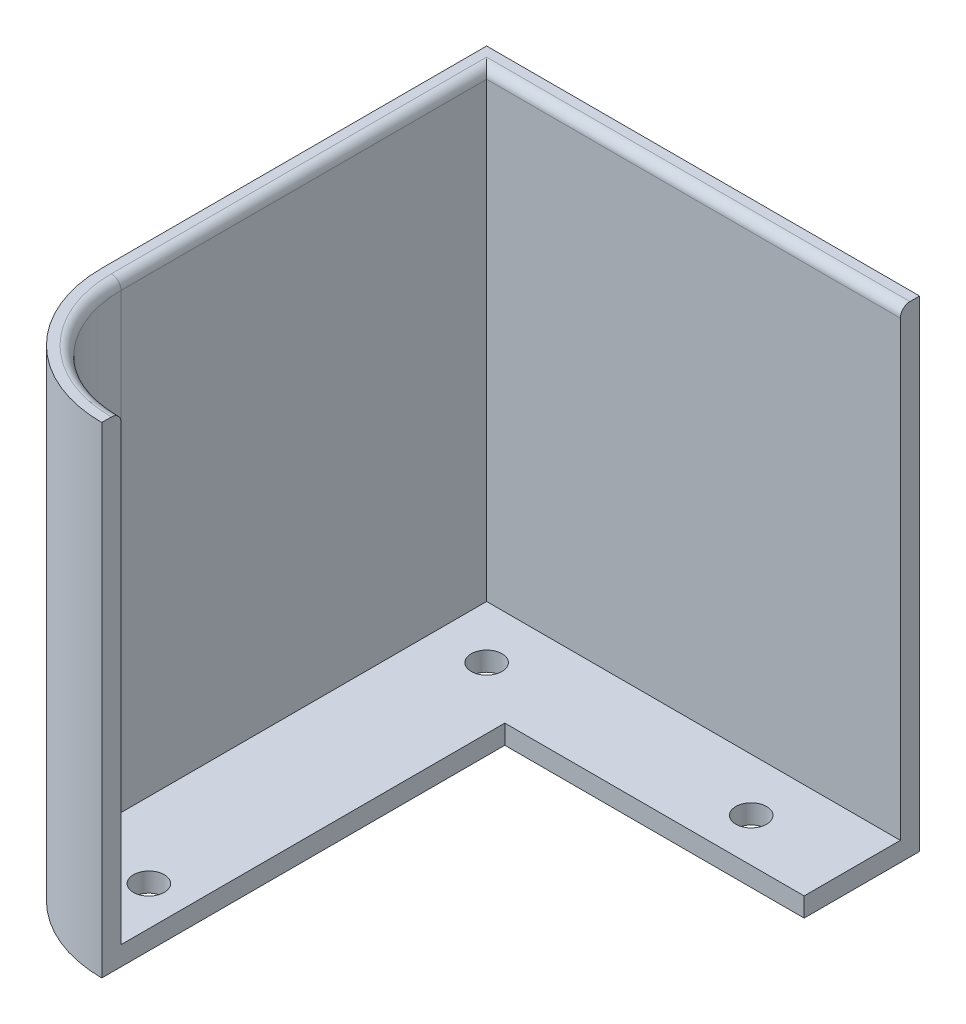
from build123d import *

# Parameters (mm, degrees)
BOSS_EXTRUDE1_DEPTH = 50
CUT_EXTRUDE1_DEPTH  = 48
SKETCH3_R           = 1.6
CUT_EXTRUDE2_DEPTH  = 840.282109633
FILLET3_R           = 1


with BuildPart() as part:
    # Sketch1 → Boss-Extrude1 (new body)
    with BuildSketch(Plane(origin=(0, 0, 0), x_dir=(1, 0, 0), z_dir=(0, 1, 0))):
        with BuildLine():
            Line((789.147942738, -65.404824394), (789.147942738, -25.404824394))
            Line((789.147942738, -25.404824394), (834.147942738, -25.404824394))
            Line((834.147942738, -25.404824394), (834.147942738, -37.404824394))
            Line((834.147942738, -37.404824394), (803.037942738, -37.404824394))
            Line((803.037942738, -37.404824394), (803.037942738, -58.807263418))
            Line((803.037942738, -58.807263418), (803.037942738, -79.294824394))
            ThreePointArc((803.037942738, -79.294824394), (793.216229548, -75.226537585), (789.147942738, -65.404824394))
        make_face()
    extrude(amount=BOSS_EXTRUDE1_DEPTH)

    # Sketch2 → Cut-Extrude1 (cut)
    with BuildSketch(Plane(origin=(0, 50, 0), x_dir=(1, 0, 0), z_dir=(0, 1, 0))):
        with BuildLine():
            Line((834.147942738, -27.404824394), (791.147942738, -27.404824394))
            Line((791.147942738, -27.404824394), (791.147942738, -65.404824394))
            ThreePointArc((791.147942738, -65.404824394), (794.630556885, -73.81166102), (803.037942738, -77.292949065))
            Line((803.037942738, -77.292949065), (834.147942738, -63.276412727))
            Line((834.147942738, -63.276412727), (834.147942738, -27.404824394))
        make_face()
    extrude(amount=-CUT_EXTRUDE1_DEPTH, mode=Mode.SUBTRACT)

    # Sketch3 → Cut-Extrude2 (cut, through all)
    with BuildSketch(Plane(origin=(0, 2, 0), x_dir=(1, 0, 0), z_dir=(0, 1, 0))):
        with Locations(Location((824.147942738, -32.904824394, 0), (0, 0, 270))):
            Circle(SKETCH3_R)
        with Locations(Location((796.647942738, -32.904824394, 0), (0, 0, 270))):
            Circle(SKETCH3_R)
        with Locations(Location((798.982858952, -70.344824394, 0), (0, 0, 270))):
            Circle(SKETCH3_R)
    extrude(amount=-CUT_EXTRUDE2_DEPTH, mode=Mode.SUBTRACT)

    # Fillet3
    fillet3_edges = [part.edges().sort_by_distance(p)[0] for p in [
        (794.630556885, 50, 73.81166102),
        (812.647942738, 50, 27.404824394),
        (791.147942738, 50, 46.404824394),
    ]]
    fillet(fillet3_edges, radius=FILLET3_R)


solid = part.part
